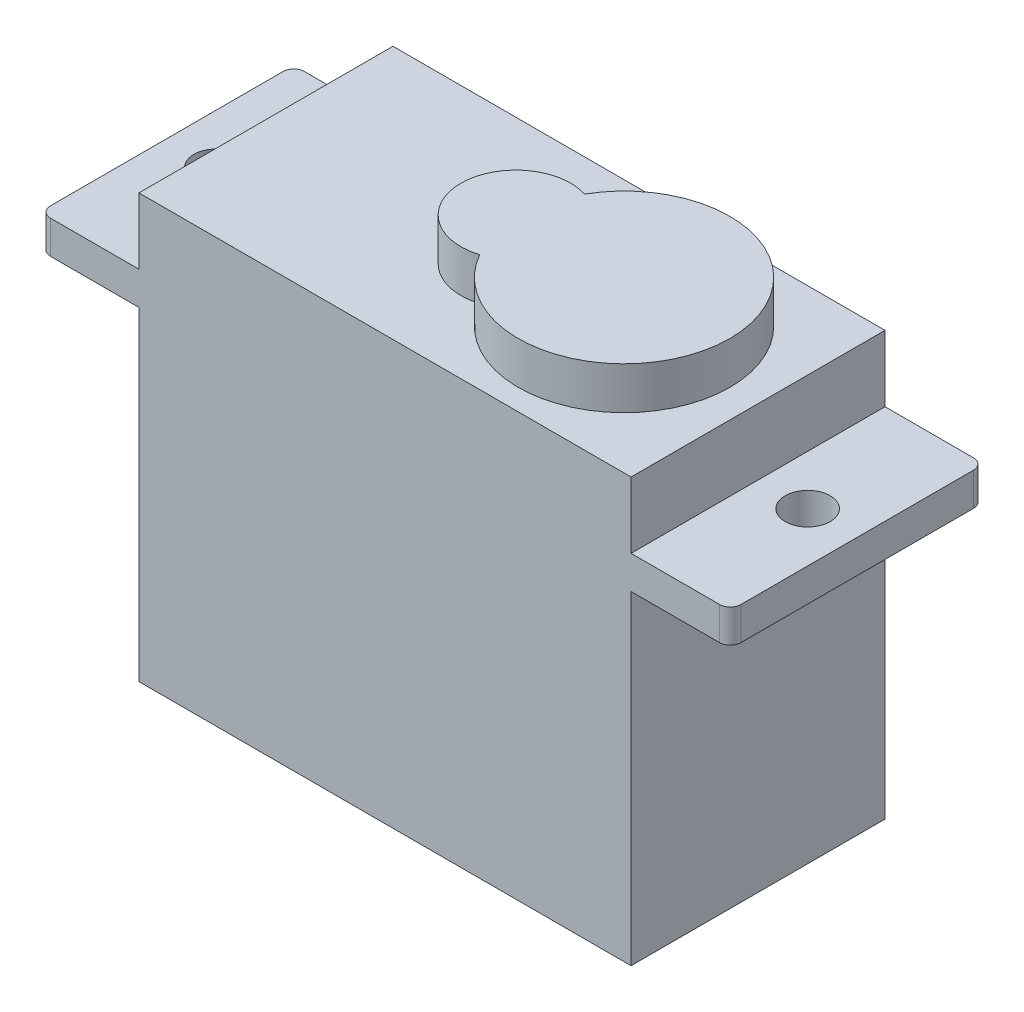
from build123d import *

# Parameters (mm, degrees)
SKETCH1_W           = 23.622
SKETCH1_H           = 12.192
BOSS_EXTRUDE1_DEPTH = 20.32
SKETCH2_R           = 5.080697271
BOSS_EXTRUDE2_DEPTH = 2.032
SKETCH3_W           = 12.192
SKETCH3_H           = 1.5875
BOSS_EXTRUDE3_DEPTH = 4.7625
CUT_EXTRUDE1_REACH  = 26.613
SKETCH5_R           = 1.0795
FILLET1_R           = 0.508


with BuildPart() as part:
    # Sketch1 → Boss-Extrude1 (new body)
    with BuildSketch(Plane(origin=(0, 0, 0), x_dir=(1, 0, 0), z_dir=(0, 1, 0))):
        Rectangle(SKETCH1_W, SKETCH1_H)
    extrude(amount=BOSS_EXTRUDE1_DEPTH)

    # Sketch2 → Boss-Extrude2 (add)
    with BuildSketch(Plane(origin=(0, 20.32, 0), x_dir=(1, 0, 0), z_dir=(0, 1, 0))):
        with Locations((5.378708036, 0)):
            Circle(SKETCH2_R)
        with BuildLine():
            ThreePointArc((0.966939793, -2.519878116), (0.298010766, 0), (0.966939793, 2.519878116))
            ThreePointArc((0.966939793, 2.519878116), (-2.454485361, 0), (0.966939793, -2.519878116))
        make_face()
    extrude(amount=BOSS_EXTRUDE2_DEPTH)

    # Sketch3 → Boss-Extrude3 (add)
    with BuildSketch(Plane(origin=(11.811, 0, 0), x_dir=(0, 0, -1), z_dir=(1, 0, 0))):
        with Locations((0, 16.35125)):
            Rectangle(SKETCH3_W, SKETCH3_H)
    boss_extrude3 = extrude(amount=BOSS_EXTRUDE3_DEPTH)

    # Sketch5 → Cut-Extrude1 (cut, up to next)
    with BuildSketch(Plane(origin=(0, 17.145, 0), x_dir=(1, 0, 0), z_dir=(0, 1, 0)), mode=Mode.PRIVATE) as cut_extrude1_sk1:
        with Locations(Location((14.19225, 0, 0), (0, 0, 270))):
            Circle(SKETCH5_R)
    cut_extrude1_tool1 = extrude(cut_extrude1_sk1.sketch, amount=-CUT_EXTRUDE1_REACH, mode=Mode.PRIVATE) & part.part
    cut_extrude1 = cut_extrude1_tool1.solids().sort_by_distance((14.19225, 17.145, 0))[0]
    add(cut_extrude1, mode=Mode.SUBTRACT)

    # Mirror1: Boss-Extrude3, Cut-Extrude1 across plane
    add(boss_extrude3.mirror(Plane(origin=(0, 0, 0), x_dir=(0, 0, 1), z_dir=(1, 0, 0))))
    add(cut_extrude1.mirror(Plane(origin=(0, 0, 0), x_dir=(0, 0, 1), z_dir=(1, 0, 0))), mode=Mode.SUBTRACT)

    # Fillet1
    fillet1_edges = [part.edges().sort_by_distance(p)[0] for p in [
        (16.5735, 16.35125, 6.096),
        (16.5735, 16.35125, -6.096),
        (-16.5735, 16.35125, 6.096),
        (-16.5735, 16.35125, -6.096),
    ]]
    fillet(fillet1_edges, radius=FILLET1_R)


solid = part.part
